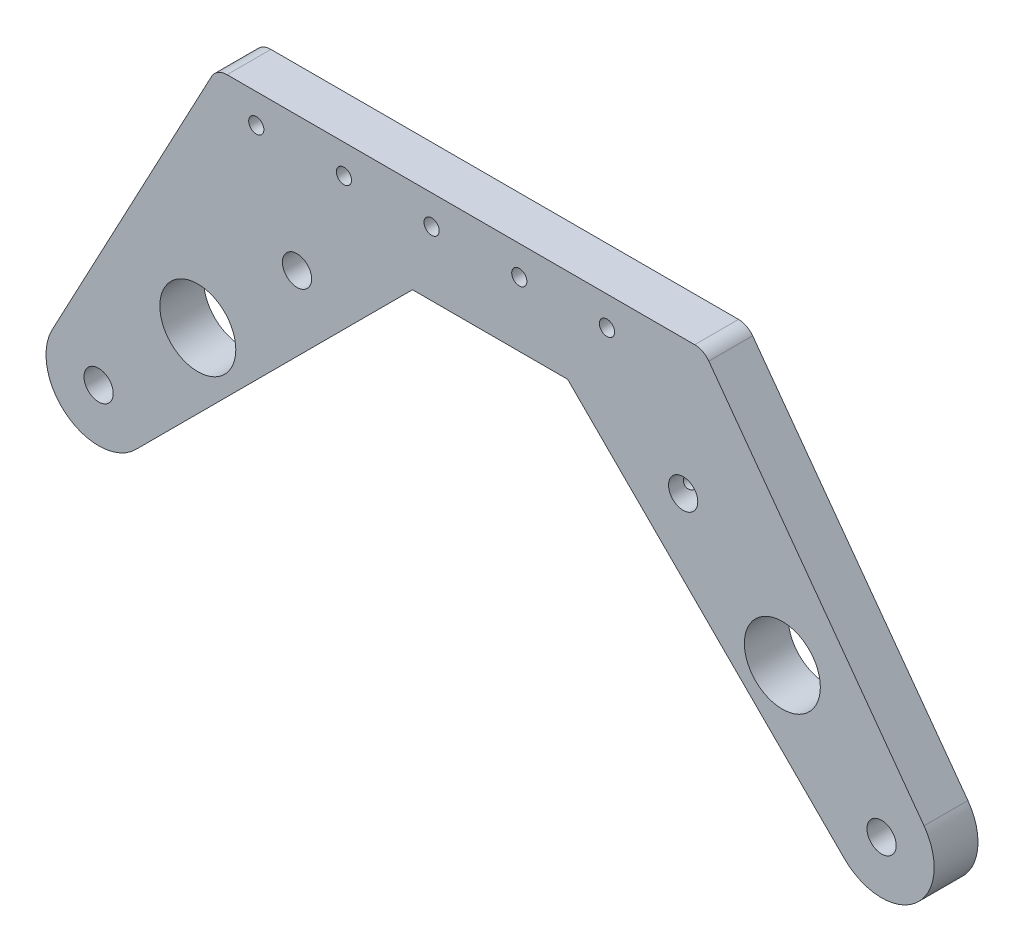
from build123d import *

# Parameters (mm, degrees)
SKETCH_2_R          = 6.5
SKETCH_2_R_2        = 1.3
SKETCH_2_R_3        = 2.5
EXTRUDE_1_DEPTH     = 7.5
SKETCH_10_R         = 1.3
CUT_EXTRUDE_2_DEPTH = 7.5
SKETCH_4_R          = 1.3
CUT_EXTRUDE_4_DEPTH = 7.5
CHAMFER_2_SIZE      = 0.2
CHAMFER_3_SIZE      = 0.2
CHAMFER_4_SIZE      = 0.5


with BuildPart() as part:
    # 草圖2 → 填料-伸長1 (new body)
    with BuildSketch(Plane.XY):
        with BuildLine():
            Line((40, 40), (5, 40))
            ThreePointArc((5, 40), (3.456243754, 39.57231737), (2.352645995, 38.411211101))
            Line((2.352645995, 38.411211101), (-24.912624764, -12.736929445))
            ThreePointArc((-24.912624764, -12.736929445), (-22.327787039, -24.202446867), (-10.606601718, -23.334523779))
            Line((-10.606601718, -23.334523779), (36.727922061, 24))
            Line((36.727922061, 24), (63.272077939, 24))
            Line((63.272077939, 24), (110.606601718, -23.334523779))
            ThreePointArc((110.606601718, -23.334523779), (122.823351862, -23.807584), (124.239699521, -11.663996007))
            Line((124.239699521, -11.663996007), (87.423045591, 38.768855581))
            ThreePointArc((87.423045591, 38.768855581), (86.358939524, 39.674562276), (85, 40))
            Line((85, 40), (40, 40))
        make_face()
        Circle(SKETCH_2_R, mode=Mode.SUBTRACT)
        with Locations((100, 0)):
            Circle(SKETCH_2_R, mode=Mode.SUBTRACT)
        with Locations((25, 35)):
            Circle(SKETCH_2_R_2, mode=Mode.SUBTRACT)
        with Locations((70, 35)):
            Circle(SKETCH_2_R_2, mode=Mode.SUBTRACT)
        with Locations((40, 35)):
            Circle(SKETCH_2_R_2, mode=Mode.SUBTRACT)
        with Locations((55, 35)):
            Circle(SKETCH_2_R_2, mode=Mode.SUBTRACT)
        with Locations((10, 35)):
            Circle(SKETCH_2_R_2, mode=Mode.SUBTRACT)
        with Locations((16.970562748, 16.970562748)):
            Circle(SKETCH_2_R_3, mode=Mode.SUBTRACT)
        with Locations((83.029437252, 16.970562748)):
            Circle(SKETCH_2_R_3, mode=Mode.SUBTRACT)
        with Locations((-16.970562748, -16.970562748)):
            Circle(SKETCH_2_R_3, mode=Mode.SUBTRACT)
        with Locations((116.970562748, -16.970562748)):
            Circle(SKETCH_2_R_3, mode=Mode.SUBTRACT)
    extrude(amount=EXTRUDE_1_DEPTH)

    # 草圖10 → 除料-伸長2 (cut)
    with BuildSketch(Plane(origin=(43.636038969, 43.636038969, 0), x_dir=(-0.70710678118655, 0.7071067811865451, 0), z_dir=(-0.7071067811865451, -0.70710678118655, 0))):
        with Locations(Location((-45.710678119, -3.75, 0), (0, 0, 180))):
            Circle(SKETCH_10_R)
        with Locations(Location((-35.710678119, -3.75, 0), (0, 0, 180))):
            Circle(SKETCH_10_R)
    extrude(amount=-CUT_EXTRUDE_2_DEPTH, mode=Mode.SUBTRACT)

    # 草圖4 → 除料-伸長4 (cut)
    with BuildSketch(Plane(origin=(6.363961031, -6.363961031, 0), x_dir=(-0.7071067811865464, -0.7071067811865488, 0), z_dir=(0.7071067811865488, -0.7071067811865464, 0))):
        with Locations(Location((-25, -3.75, 0), (0, 0, 180))):
            Circle(SKETCH_4_R)
        with Locations(Location((-35, -3.75, 0), (0, 0, 180))):
            Circle(SKETCH_4_R)
    extrude(amount=-CUT_EXTRUDE_4_DEPTH, mode=Mode.SUBTRACT)

    # 導角2
    chamfer_2_edges = [part.edges().sort_by_distance(p)[0] for p in [
        (67.968062812, 19.304015126, 3.75),
        (75.039130624, 12.232947315, 3.75),
    ]]
    chamfer(chamfer_2_edges, length=CHAMFER_2_SIZE)

    # 導角3
    chamfer_3_edges = [part.edges().sort_by_distance(p)[0] for p in [
        (23.122391745, 10.394469683, 3.75),
        (30.193459557, 17.465537495, 3.75),
    ]]
    chamfer(chamfer_3_edges, length=CHAMFER_3_SIZE)

    # 導角4
    chamfer_4_edges = [part.edges().sort_by_distance(p)[0] for p in [
        (14.470562748, 16.970562748, 0),
        (80.529437252, 16.970562748, 0),
        (114.470562748, -16.970562748, 0),
        (-19.470562748, -16.970562748, 0),
    ]]
    chamfer(chamfer_4_edges, length=CHAMFER_4_SIZE)


solid = part.part
